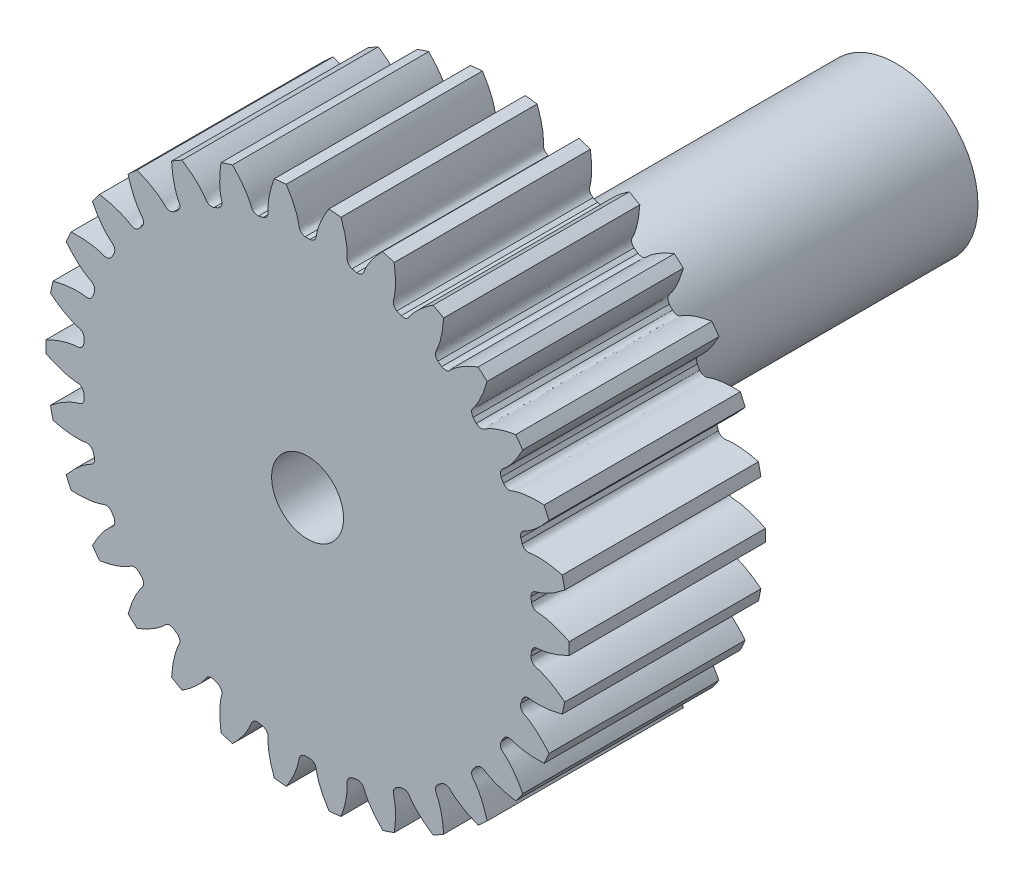
from build123d import *

# Parameters (mm, degrees)
SKETCH_1_R               = 16
EXTRUDE_1_DEPTH          = 12
CUT_EXTRUDE_1_DEPTH      = 26.61249695
PATTERN_CIRCULAR_1_COUNT = 30
CUT_EXTRUDE_2_DEPTH      = 26.579191516
CUT_EXTRUDE_2_DEPTH_BACK = 26.579191516
SKETCH_4_R               = 5
SKETCH_6_R               = 5
SKETCH_6_R_2             = 2.2
EXTRUDE_2_DEPTH          = 36


with BuildPart() as part:
    # 草图1 → 凸台-拉伸1 (new body)
    with BuildSketch(Plane.XY):
        Circle(SKETCH_1_R)
    extrude(amount=EXTRUDE_1_DEPTH)

    # 草图2 → 切除-拉伸1 (cut, through all)
    with BuildSketch(Plane.XY):
        with BuildLine():
            ThreePointArc((0.145558629, 13.749229531), (0, 13.75), (-0.145558629, 13.749229531))
            add(Edge.make_bspline(
                [(-0.145558629, 13.749229531), (-0.50823069, 13.81297517), (-0.510304747, 14.047132636), (-0.55898482, 14.288579015), (-0.569950741, 14.338129238), (-0.583247086, 14.392924909), (-0.599067717, 14.452897992), (-0.617630624, 14.517964907), (-0.639143358, 14.588038514), (-0.663813512, 14.663024477), (-0.691845294, 14.742822461), (-0.723440342, 14.827325855), (-0.758797267, 14.91642195), (-0.798111576, 15.009991983), (-0.841575482, 15.107911227), (-0.889377751, 15.210049075), (-0.941703547, 15.316269128), (-0.99873427, 15.426429286), (-1.060647407, 15.54038185), (-1.127616379, 15.657973616), (-1.199810393, 15.779045984), (-1.277394296, 15.903435064), (-1.36052843, 16.030971789), (-1.449368495, 16.161482028), (-1.544065407, 16.294786707), (-1.644765164, 16.430701934), (-1.751608718, 16.569039116), (-1.864731839, 16.709605098), (-1.984264996, 16.85220229), (-2.110333232, 16.996628804), (-2.243056043, 17.14267859), (-2.382547265, 17.290141584), (-2.528914958, 17.438803847), (-2.682261311, 17.588447714), (-2.842682483, 17.738851945), (-3.068923866, 17.942620828), (-3.245344618, 18.092071531), (-3.366311832, 18.190558123)],
                knots=[0, 0, 0, 0, 0.115323882, 0.12341257, 0.132512303, 0.142623081, 0.153744905, 0.165877774, 0.179021689, 0.193176649, 0.208342655, 0.224519706, 0.241707802, 0.259906945, 0.279117132, 0.299338365, 0.320570644, 0.342813968, 0.366068337, 0.390333752, 0.415610213, 0.441897719, 0.46919627, 0.497505867, 0.52682651, 0.557158198, 0.588500931, 0.62085471, 0.654219534, 0.688595404, 0.723982319, 0.76038028, 0.797789286, 0.836209338, 0.875640435, 0.916082578, 1, 1, 1, 1], degree=3))
            ThreePointArc((-3.366311832, 18.190558123), (0, 18.499417833), (3.366311832, 18.190558123))
            add(Edge.make_bspline(
                [(0.145558629, 13.749229531), (0.50823069, 13.81297517), (0.510304747, 14.047132636), (0.55898482, 14.288579015), (0.569950741, 14.338129238), (0.583247086, 14.392924909), (0.599067717, 14.452897992), (0.617630624, 14.517964907), (0.639143358, 14.588038514), (0.663813512, 14.663024477), (0.691845294, 14.742822461), (0.723440342, 14.827325855), (0.758797267, 14.91642195), (0.798111576, 15.009991983), (0.841575482, 15.107911227), (0.889377751, 15.210049075), (0.941703547, 15.316269128), (0.99873427, 15.426429286), (1.060647407, 15.54038185), (1.127616379, 15.657973616), (1.199810393, 15.779045984), (1.277394296, 15.903435064), (1.36052843, 16.030971789), (1.449368495, 16.161482028), (1.544065407, 16.294786707), (1.644765164, 16.430701934), (1.751608718, 16.569039116), (1.864731839, 16.709605098), (1.984264996, 16.85220229), (2.110333232, 16.996628804), (2.243056043, 17.14267859), (2.382547265, 17.290141584), (2.528914958, 17.438803847), (2.682261311, 17.588447714), (2.842682483, 17.738851945), (3.068923866, 17.942620828), (3.245344618, 18.092071531), (3.366311832, 18.190558123)],
                knots=[0, 0, 0, 0, 0.115323882, 0.12341257, 0.132512303, 0.142623081, 0.153744905, 0.165877774, 0.179021689, 0.193176649, 0.208342655, 0.224519706, 0.241707802, 0.259906945, 0.279117132, 0.299338365, 0.320570644, 0.342813968, 0.366068337, 0.390333752, 0.415610213, 0.441897719, 0.46919627, 0.497505867, 0.52682651, 0.557158198, 0.588500931, 0.62085471, 0.654219534, 0.688595404, 0.723982319, 0.76038028, 0.797789286, 0.836209338, 0.875640435, 0.916082578, 1, 1, 1, 1], degree=3))
        make_face()
    cut_extrude_1 = extrude(amount=CUT_EXTRUDE_1_DEPTH, mode=Mode.SUBTRACT)

    # 阵列(圆周)1: 切除-拉伸1 ×30 about axis
    pattern_circular_1_axis = Axis((0, 0, 12), (0, 0, -1))
    for i in range(1, PATTERN_CIRCULAR_1_COUNT):
        add(cut_extrude_1.rotate(pattern_circular_1_axis, i * 360 / PATTERN_CIRCULAR_1_COUNT), mode=Mode.SUBTRACT)

    # 草图4 → 切除-拉伸2 (cut, two sides: drawn at the far end of the back side and taken through both)
    with BuildSketch(Plane.XY.offset(12).offset(-CUT_EXTRUDE_2_DEPTH_BACK)):
        Circle(SKETCH_4_R)
    extrude(amount=CUT_EXTRUDE_2_DEPTH + CUT_EXTRUDE_2_DEPTH_BACK, mode=Mode.SUBTRACT)

    # 草图6 → 凸台-拉伸2 (add)
    with BuildSketch(Plane.XY.offset(12)):
        Circle(SKETCH_6_R)
        Circle(SKETCH_6_R_2, mode=Mode.SUBTRACT)
    extrude(amount=-EXTRUDE_2_DEPTH)


solid = part.part
